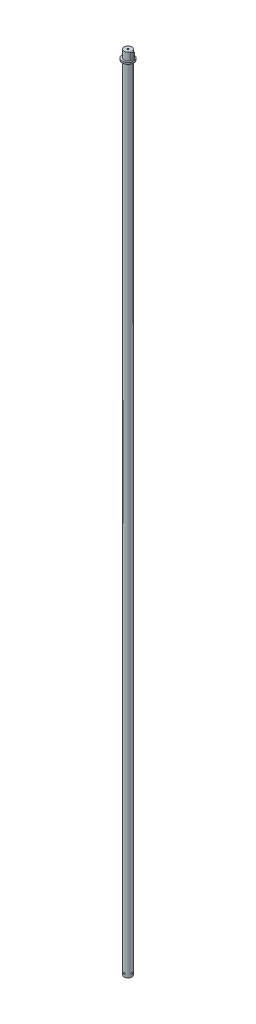
from build123d import *

# Parameters (mm, degrees)
SKETCH1_R           = 5
BOSS_EXTRUDE1_DEPTH = 1050
SKETCH2_R           = 7.5
BOSS_EXTRUDE2_DEPTH = 2
BOSS_EXTRUDE4_DEPTH = 10
SKETCH8_R           = 1
CUT_EXTRUDE1_DEPTH  = 3
SKETCH9_R           = 1
CUT_EXTRUDE2_DEPTH  = 10
CIRPATTERN1_COUNT   = 4


with BuildPart() as part:
    # Sketch1 → Boss-Extrude1 (new body)
    with BuildSketch(Plane(origin=(0, 0, 0), x_dir=(1, 0, 0), z_dir=(0, 1, 0))):
        with Locations(Location((0, 0, 0), (0, 0, 270))):
            Circle(SKETCH1_R)
    extrude(amount=BOSS_EXTRUDE1_DEPTH)

    # Sketch2 → Boss-Extrude2 (add)
    with BuildSketch(Plane(origin=(0, 1040, 0), x_dir=(1, 0, 0), z_dir=(0, 1, 0))):
        with Locations(Location((0, 0, 0), (0, 0, 270))):
            Circle(SKETCH2_R)
    extrude(amount=-BOSS_EXTRUDE2_DEPTH)

    # Sketch4 → Boss-Extrude4 (add)
    with BuildSketch(Plane(origin=(0, 1040, 0), x_dir=(1, 0, 0), z_dir=(0, 1, 0))):
        with BuildLine():
            ThreePointArc((4.898979486, 1), (4.974680765, 0.50254481), (5, 0))
            Line((5, 0), (7.5, 0))
            ThreePointArc((7.5, 0), (7.483239867, 0.501119845), (7.433034374, 1))
            Line((7.433034374, 1), (4.898979486, 1))
        make_face()
        with BuildLine():
            Line((7.5, 0), (5, 0))
            ThreePointArc((5, 0), (4.974680765, -0.50254481), (4.898979486, -1))
            Line((4.898979486, -1), (7.433034374, -1))
            ThreePointArc((7.433034374, -1), (7.483239867, -0.501119845), (7.5, 0))
        make_face()
    extrude(amount=BOSS_EXTRUDE4_DEPTH)

    # Sketch8 → Cut-Extrude1 (cut)
    with BuildSketch(Plane(origin=(0, 1050, 0), x_dir=(1, 0, 0), z_dir=(0, 1, 0))):
        with Locations(Location((0, 0, 0), (0, 0, 270))):
            Circle(SKETCH8_R)
    extrude(amount=-CUT_EXTRUDE1_DEPTH, mode=Mode.SUBTRACT)

    # Sketch9 → Cut-Extrude2 (cut)
    with BuildSketch(Plane.XY):
        with Locations((0, 4)):
            Circle(SKETCH9_R)
    cut_extrude2 = extrude(amount=-CUT_EXTRUDE2_DEPTH, mode=Mode.SUBTRACT)

    # CirPattern1: Cut-Extrude2 ×4 about axis
    cirpattern1_axis = Axis((0, 1050, 0), (0, -1, 0))
    for i in range(1, CIRPATTERN1_COUNT):
        add(cut_extrude2.rotate(cirpattern1_axis, i * 360 / CIRPATTERN1_COUNT), mode=Mode.SUBTRACT)


solid = part.part
